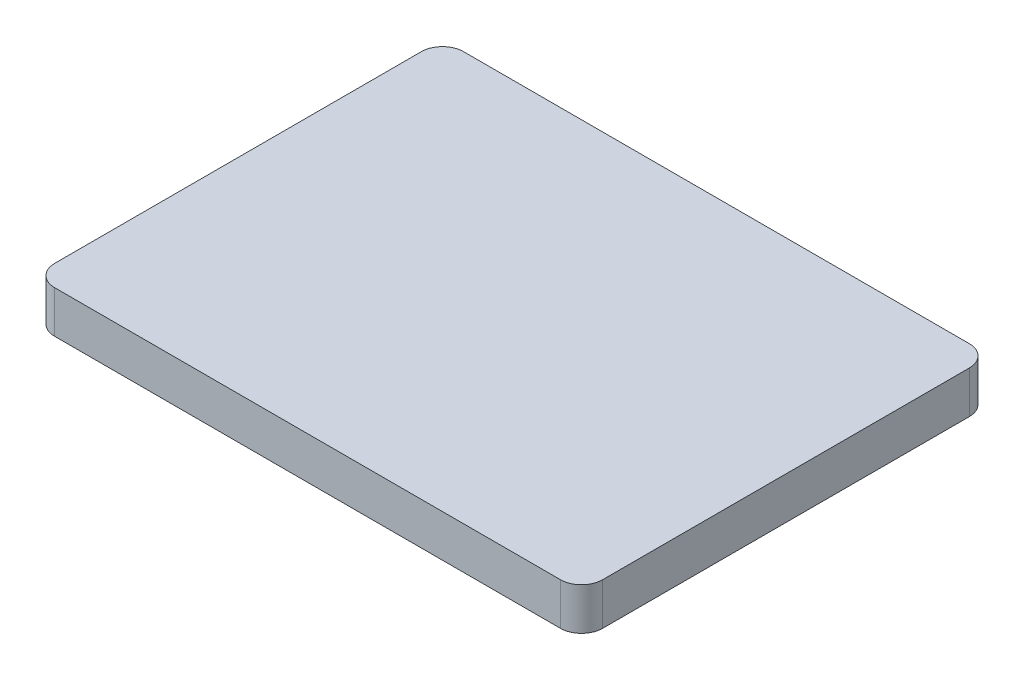
from build123d import *

# Parameters (mm, degrees)
SKETCH1_W           = 130
SKETCH1_H           = 97
BOSS_EXTRUDE1_DEPTH = 10
FILLET1_R           = 5


with BuildPart() as part:
    # Sketch1 → Boss-Extrude1 (new body)
    with BuildSketch(Plane(origin=(0, 0, 0), x_dir=(1, 0, 0), z_dir=(0, 1, 0))):
        Rectangle(SKETCH1_W, SKETCH1_H)
    extrude(amount=-BOSS_EXTRUDE1_DEPTH)

    # Fillet1
    fillet1_edges = [part.edges().sort_by_distance(p)[0] for p in [
        (65, -5, 48.5),
        (-65, -5, 48.5),
        (-65, -5, -48.5),
        (65, -5, -48.5),
    ]]
    fillet(fillet1_edges, radius=FILLET1_R)


solid = part.part
